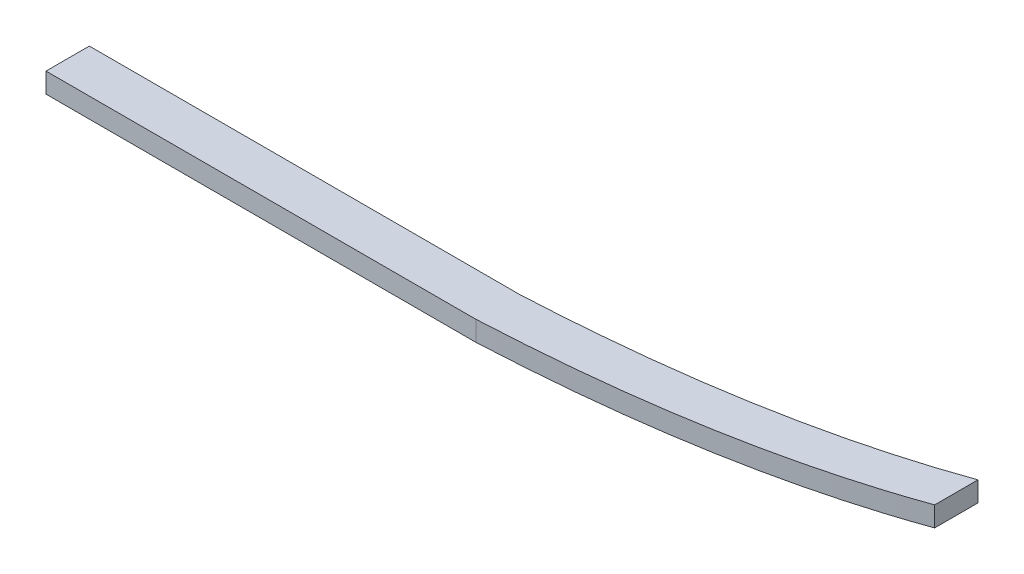
from build123d import *

# Parameters (mm, degrees)
BOSS_EXTRUDE1_DEPTH = 3


with BuildPart() as part:
    # Sketch1 → Boss-Extrude1 (new body)
    with BuildSketch(Plane(origin=(0, 0, 0), x_dir=(1, 0, 0), z_dir=(0, 1, 0))):
        with BuildLine():
            Line((0, 0), (61.5, 0))
            add(Edge.make_bspline(
                [(61.5, 0), (96.079868576, 1.689945504), (120.026085552, 10.3)],
                knots=[0, 0, 0, 1, 1, 1], degree=2))
            Line((120.026085552, 10.3), (120.028762053, 16.803234674))
            add(Edge.make_bspline(
                [(61.5, 6.5), (96.082545077, 8.193180177), (120.028762053, 16.803234674)],
                knots=[0, 0, 0, 1, 1, 1], degree=2))
            Line((61.5, 6.5), (0, 6.5))
            Line((0, 6.5), (-3, 6.5))
            Line((-3, 6.5), (-3, 0))
            Line((-3, 0), (0, 0))
        make_face()
    extrude(amount=BOSS_EXTRUDE1_DEPTH)


solid = part.part
